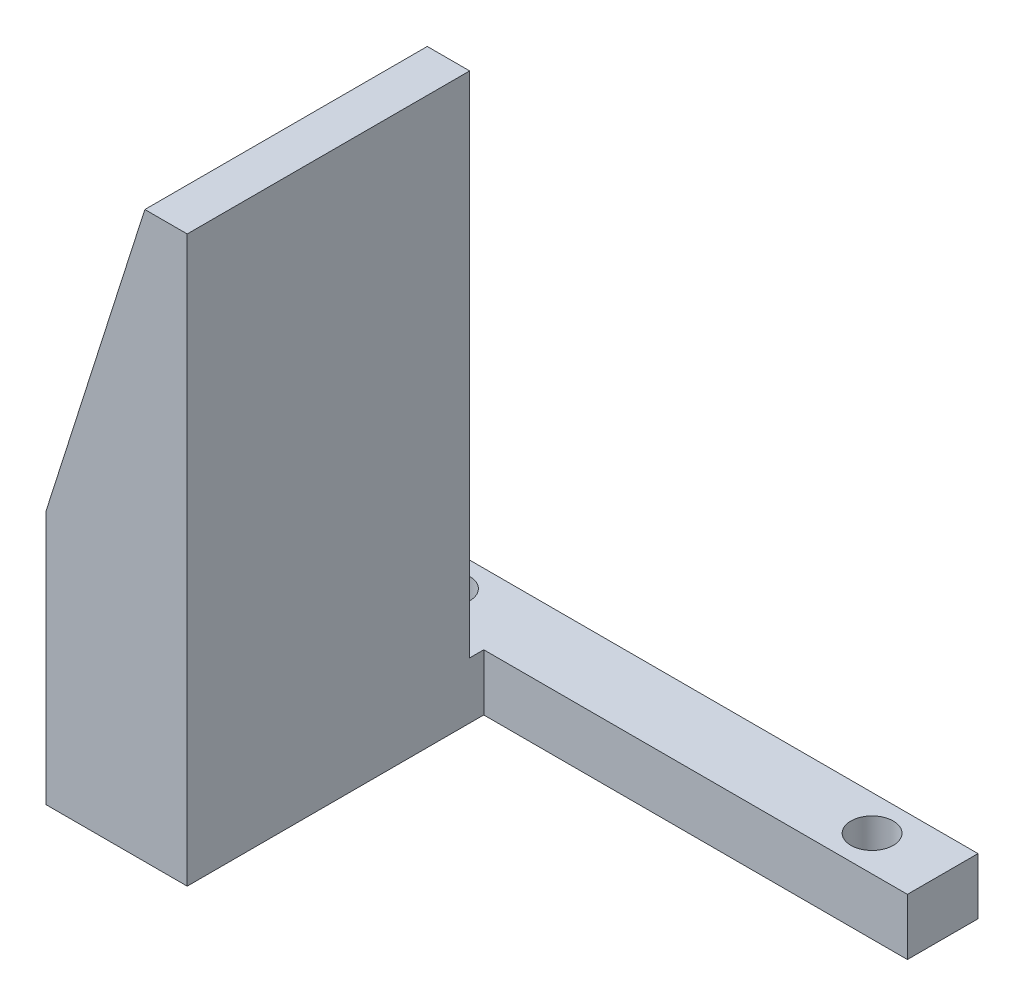
from build123d import *

# Parameters (mm, degrees)
BOSS_EXTRUDE1_DEPTH = 20
SKETCH2_R           = 1.5
BOSS_EXTRUDE2_DEPTH = 4


with BuildPart() as part:
    # Sketch1 → Boss-Extrude1 (new body)
    with BuildSketch(Plane.XY):
        Polygon((0, 0), (0, 40), (-3, 40), (-10, 18), (-10, 0), align=None)
    extrude(amount=BOSS_EXTRUDE1_DEPTH)

    # Sketch2 → Boss-Extrude2 (add)
    with BuildSketch(Plane.XZ):
        Polygon((-10, 0), (-10, -6), (30, -6), (30, -1), (0, -1), (0, 0), align=None)
        with Locations(Location((25, -3.5, 0), (0, 0, 270))):
            Circle(SKETCH2_R, mode=Mode.SUBTRACT)
        with Locations(Location((-5, -3.5, 0), (0, 0, 270))):
            Circle(SKETCH2_R, mode=Mode.SUBTRACT)
    extrude(amount=-BOSS_EXTRUDE2_DEPTH)


solid = part.part
